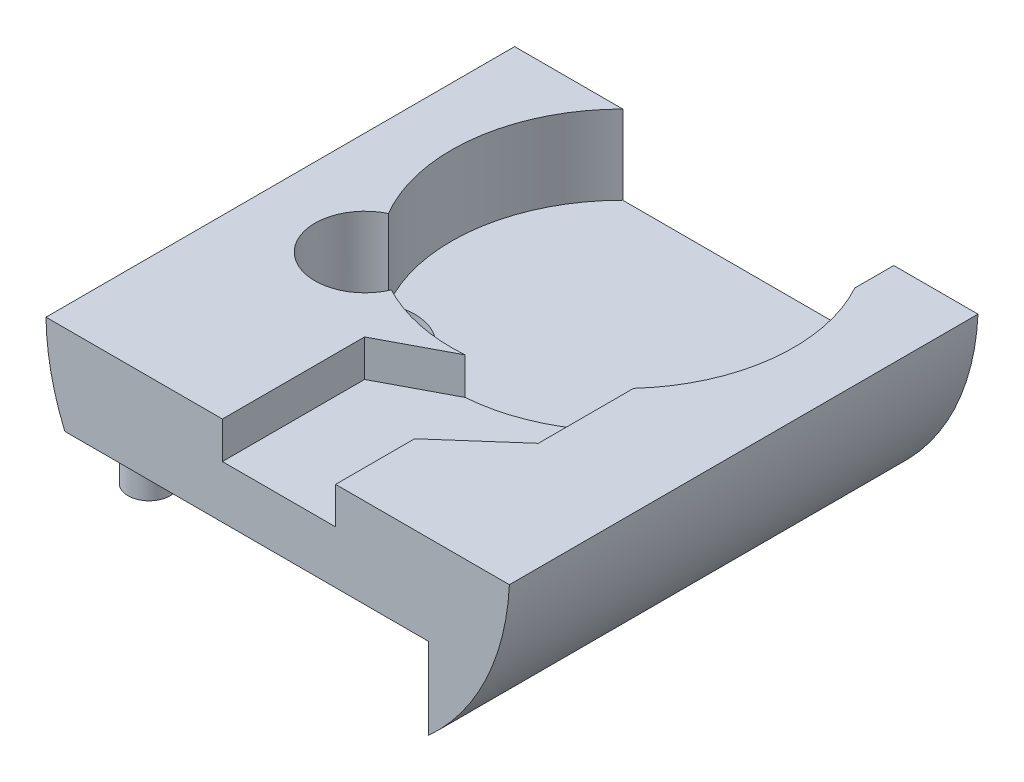
from build123d import *

# Parameters (mm, degrees)
SKETCH1_W           = 87.952115464
SKETCH1_H           = 84
BOSS_EXTRUDE1_DEPTH = 44
CUT_EXTRUDE1_DEPTH  = 105.526999639
CUT_EXTRUDE2_DEPTH  = 94
BOSS_EXTRUDE2_DEPTH = 5
CUT_EXTRUDE4_DEPTH  = 108.023520294
BOSS_EXTRUDE3_DEPTH = 89
SKETCH12_W          = 66.643398472
SKETCH12_H          = 89
CUT_EXTRUDE5_DEPTH  = 21
SKETCH13_W          = 89
SKETCH13_H          = 4.850314153
CUT_EXTRUDE6_DEPTH  = 15
SKETCH14_R          = 9.5
CUT_EXTRUDE7_DEPTH  = 67.996371003
SKETCH15_R          = 4
SKETCH15_R_2        = 1.5
BOSS_EXTRUDE4_DEPTH = 5.5
CUT_EXTRUDE8_DEPTH  = 7
SKETCH17_R          = 32.5
CUT_EXTRUDE9_DEPTH  = 8


with BuildPart() as part:
    # Sketch1 → Boss-Extrude1 (new body)
    with BuildSketch(Plane(origin=(0, 0, 0), x_dir=(1, 0, 0), z_dir=(0, 1, 0))):
        Rectangle(SKETCH1_W, SKETCH1_H)
    extrude(amount=BOSS_EXTRUDE1_DEPTH)

    # Sketch3 → Cut-Extrude1 (cut, through all)
    with BuildSketch(Plane.XY.offset(42)):
        with BuildLine():
            Line((-21, 0), (21, 0))
            ThreePointArc((21, 0), (36.980443324, 19.654136956), (43.976057732, 44))
            Line((43.976057732, 44), (43.976057732, -11.97124173))
            Line((43.976057732, -11.97124173), (-43.976057732, -11.97124173))
            Line((-43.976057732, -11.97124173), (-43.976057732, 44))
            ThreePointArc((-43.976057732, 44), (-36.29063042, 20.014345617), (-21, 0))
        make_face()
    extrude(amount=-CUT_EXTRUDE1_DEPTH, mode=Mode.SUBTRACT)

    # Sketch4 → Cut-Extrude2 (cut)
    with BuildSketch(Plane.XY.offset(42)):
        with BuildLine():
            Line((-40.014597283, 44.55392338), (-43.976057732, 44))
            ThreePointArc((-43.976057732, 44), (-36.29063042, 20.014345617), (-21, 0))
            Line((-21, 0), (21, 0))
            ThreePointArc((21, 0), (36.980443324, 19.654136956), (43.976057732, 44))
            Line((43.976057732, 44), (39.988336247, 44.313173055))
            ThreePointArc((39.988336247, 44.313173055), (33.757294054, 22.132372023), (19.543536422, 4))
            Line((19.543536422, 4), (-19.406576645, 4))
            ThreePointArc((-19.406576645, 4), (-33.099796329, 22.554689448), (-40.014597283, 44.55392338))
        make_face()
    extrude(amount=-CUT_EXTRUDE2_DEPTH, mode=Mode.SUBTRACT)

    # Sketch6 → Boss-Extrude2 (add)
    with BuildSketch(Plane(origin=(0, 0, -42), x_dir=(-1, 0, 0), z_dir=(0, 0, -1))):
        with BuildLine():
            Line((-19.543536422, 4), (19.406576645, 4))
            ThreePointArc((19.406576645, 4), (32.972533813, 22.305488816), (39.934882496, 44))
            Line((39.934882496, 44), (-39.962906501, 44))
            ThreePointArc((-39.962906501, 44), (-33.686050128, 21.9923529), (-19.543536422, 4))
        make_face()
    extrude(amount=BOSS_EXTRUDE2_DEPTH)

    # Sketch8 → Cut-Extrude4 (cut, through all)
    with BuildSketch(Plane(origin=(0, 0, -47), x_dir=(-1, 0, 0), z_dir=(0, 0, -1))):
        with BuildLine():
            Line((-19.543536422, 4), (19.406576645, 4))
            ThreePointArc((19.406576645, 4), (20.408380664, 4.990013681), (21.390045584, 6))
            Line((21.390045584, 6), (-21.753352888, 6))
            ThreePointArc((-21.753352888, 6), (-20.661010919, 4.986115432), (-19.543536422, 4))
        make_face()
    extrude(amount=-CUT_EXTRUDE4_DEPTH, mode=Mode.SUBTRACT)

    # Sketch11 → Boss-Extrude3 (add)
    with BuildSketch(Plane(origin=(0, 0, -47), x_dir=(-1, 0, 0), z_dir=(0, 0, -1))):
        with BuildLine():
            Line((-21.753352888, 6), (21.390045584, 6))
            ThreePointArc((21.390045584, 6), (37.370443433, 22.115785334), (43.384826263, 44))
            Line((43.384826263, 44), (-44.615173737, 44))
            ThreePointArc((-44.615173737, 44), (-37.97109171, 22.12011544), (-21.753352888, 6))
        make_face()
    extrude(amount=-BOSS_EXTRUDE3_DEPTH)

    # Sketch12 → Cut-Extrude5 (cut)
    with BuildSketch(Plane.XZ.offset(-6)):
        with Locations((-4.068346348, -2.5)):
            Rectangle(SKETCH12_W, SKETCH12_H)
    extrude(amount=-CUT_EXTRUDE5_DEPTH, mode=Mode.SUBTRACT)

    # Sketch13 → Cut-Extrude6 (cut)
    with BuildSketch(Plane(origin=(-37.390045584, 0, 0), x_dir=(0, 0, -1), z_dir=(1, 0, 0))):
        with Locations((2.5, 24.574842924)):
            Rectangle(SKETCH13_W, SKETCH13_H)
    extrude(amount=-CUT_EXTRUDE6_DEPTH, mode=Mode.SUBTRACT)

    # Sketch14 → Cut-Extrude7 (cut, through all)
    with BuildSketch(Plane.XZ.offset(-27)):
        with Locations(Location((-23.812368574, 1, 0), (0, 0, 270))):
            Circle(SKETCH14_R)
    extrude(amount=-CUT_EXTRUDE7_DEPTH, mode=Mode.SUBTRACT)

    # Sketch15 → Boss-Extrude4 (add)
    # profile 1 of 3: a face of its own
    with BuildSketch(Plane.XZ.offset(-27)):
        with Locations(Location((-28.712368574, 37.1, 0), (0, 0, 90))):
            Circle(SKETCH15_R)
        with Locations(Location((-28.712368574, 37.1, 0), (0, 0, 270))):
            Circle(SKETCH15_R_2, mode=Mode.SUBTRACT)
    # profile 2 of 3: a face of its own
    with BuildSketch(Plane.XZ.offset(-27)):
        with Locations(Location((24.253352888, -0.4, 0), (0, 0, 90))):
            Circle(SKETCH15_R)
        with Locations(Location((24.253352888, -0.4, 0), (0, 0, 270))):
            Circle(SKETCH15_R_2, mode=Mode.SUBTRACT)
    # profile 3 of 3: a face of its own
    with BuildSketch(Plane.XZ.offset(-27)):
        with Locations(Location((-30.812368574, -34.8, 0), (0, 0, 90))):
            Circle(SKETCH15_R)
        with Locations(Location((-30.812368574, -34.8, 0), (0, 0, 270))):
            Circle(SKETCH15_R_2, mode=Mode.SUBTRACT)
    extrude(amount=BOSS_EXTRUDE4_DEPTH)

    # Sketch16 → Cut-Extrude8 (cut)
    with BuildSketch(Plane(origin=(0, 44, 0), x_dir=(1, 0, 0), z_dir=(0, 1, 0))):
        with BuildLine():
            Line((-9.884826263, -42), (11.615173737, -42))
            Line((11.615173737, -42), (11.615173737, -27))
            Line((11.615173737, -27), (24.115173737, -16))
            Line((24.115173737, -16), (24.115173737, 2.085392999))
            ThreePointArc((24.115173737, 2.085392999), (32.384099226, 20.131350652), (28.615173737, 39.620499352))
            Line((28.615173737, 39.620499352), (28.615173737, 47))
            Line((28.615173737, 47), (23.077098744, 47))
            ThreePointArc((23.077098744, 47), (-30.372036637, 35.259662676), (2.615173737, -8.403703492))
            Line((2.615173737, -8.403703492), (-9.884826263, -15))
            Line((-9.884826263, -15), (-9.884826263, -42))
        make_face()
    extrude(amount=-CUT_EXTRUDE8_DEPTH, mode=Mode.SUBTRACT)

    # Sketch17 → Cut-Extrude9 (cut)
    with BuildSketch(Plane(origin=(0, 37, 0), x_dir=(1, 0, 0), z_dir=(0, 1, 0))):
        with Locations((0.115173737, 24)):
            Circle(SKETCH17_R)
    extrude(amount=-CUT_EXTRUDE9_DEPTH, mode=Mode.SUBTRACT)


solid = part.part
